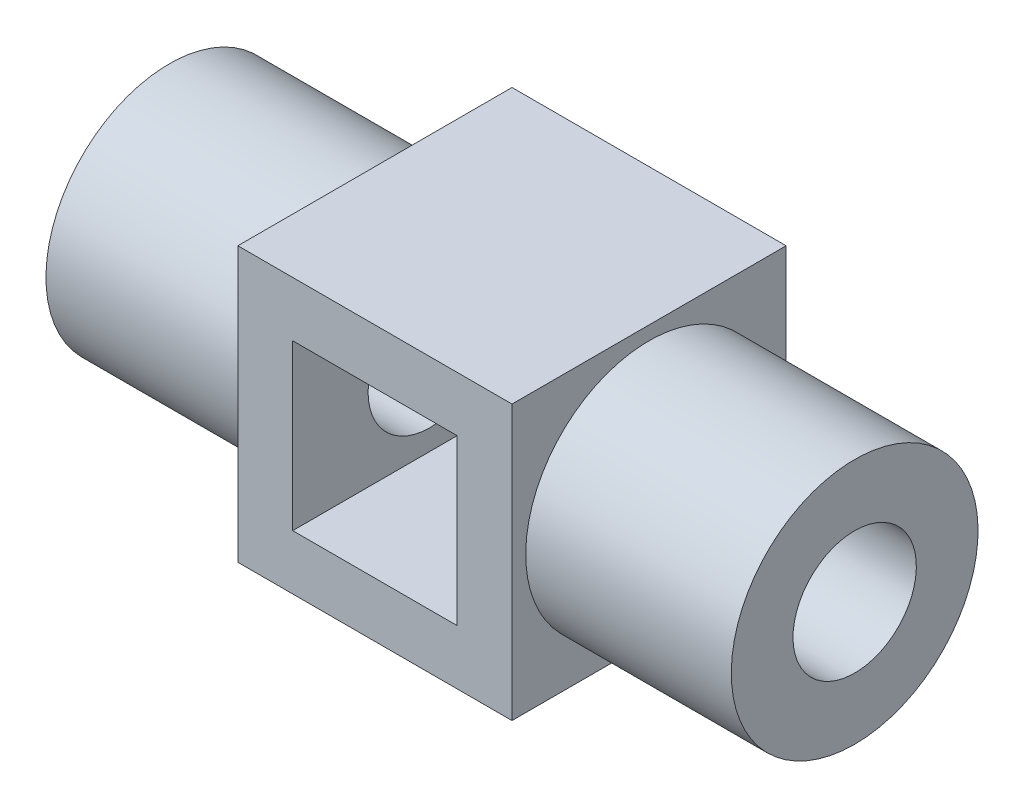
from build123d import *

# Parameters (mm, degrees)
SKETCH1_W           = 40
SKETCH1_H           = 40
SKETCH1_W_2         = 24
SKETCH1_H_2         = 24
BOSS_EXTRUDE1_DEPTH = 40
SKETCH2_R           = 18
BOSS_EXTRUDE3_DEPTH = 30
SKETCH3_R           = 9
CUT_EXTRUDE1_DEPTH  = 62


with BuildPart() as part:
    # Sketch1 → Boss-Extrude1 (new body)
    with BuildSketch(Plane.XY):
        Rectangle(SKETCH1_W, SKETCH1_H)
        Rectangle(SKETCH1_W_2, SKETCH1_H_2, mode=Mode.SUBTRACT)
    extrude(amount=BOSS_EXTRUDE1_DEPTH)

    # Sketch2 → Boss-Extrude3 (add)
    with BuildSketch(Plane.ZY.offset(20)):
        with Locations(Location((20, 0, 0), (0, 0, 270))):
            Circle(SKETCH2_R)
    boss_extrude3 = extrude(amount=BOSS_EXTRUDE3_DEPTH)

    # Sketch3 → Cut-Extrude1 (cut)
    with BuildSketch(Plane.ZY.offset(50)):
        with Locations(Location((20, 0, 0), (0, 0, 270))):
            Circle(SKETCH3_R)
    cut_extrude1 = extrude(amount=-CUT_EXTRUDE1_DEPTH, mode=Mode.SUBTRACT)

    # Mirror1: Boss-Extrude3, Cut-Extrude1 across plane
    add(boss_extrude3.mirror(Plane(origin=(0, 0, 0), x_dir=(0, 0, 1), z_dir=(1, 0, 0))))
    add(cut_extrude1.mirror(Plane(origin=(0, 0, 0), x_dir=(0, 0, 1), z_dir=(1, 0, 0))), mode=Mode.SUBTRACT)


solid = part.part
